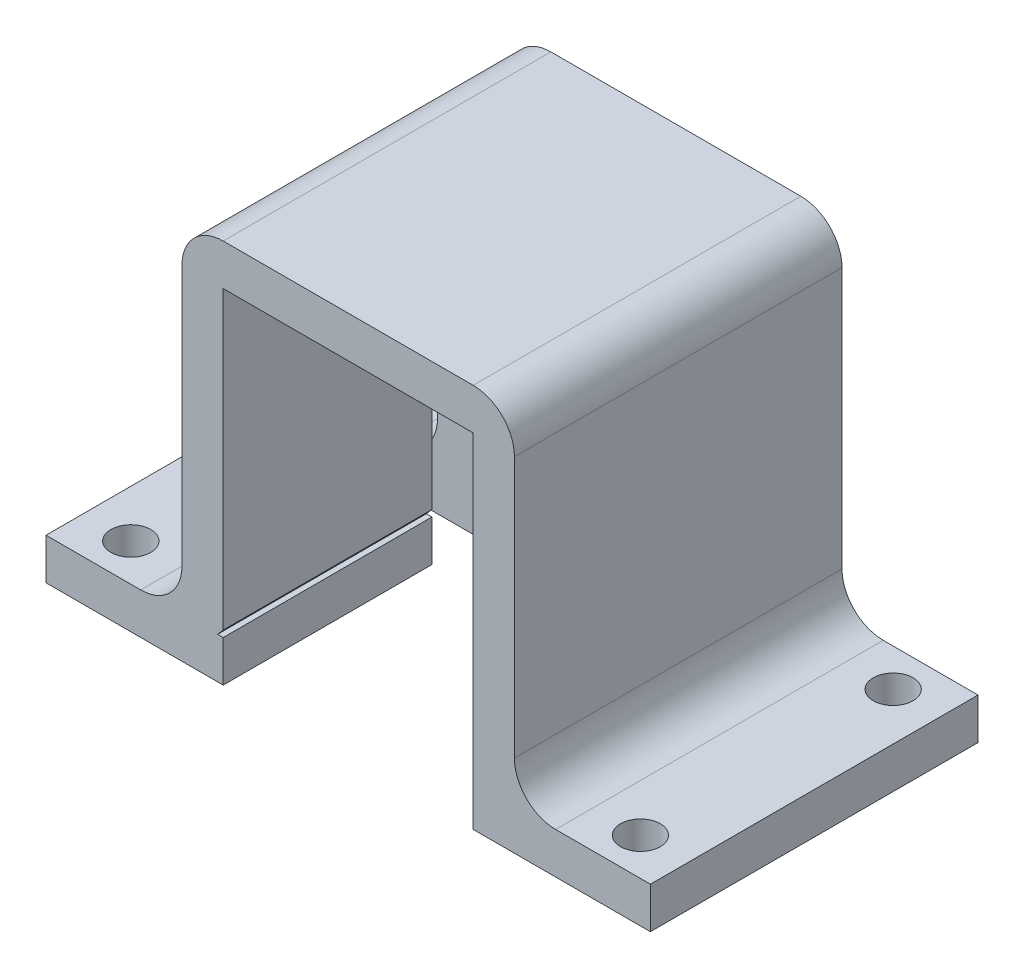
from build123d import *

# Parameters (mm, degrees)
BOSS_EXTRUDE1_DEPTH     = 23.85
SKETCH4_R               = 1.45
CUT_EXTRUDE3_DEPTH      = 10
CUT_EXTRUDE4_DEPTH      = 10
CUT_EXTRUDE4_DEPTH_BACK = 10
SKETCH10_W              = 3.4
SKETCH10_H              = 20


with BuildPart() as part:
    # Sketch1 → Boss-Extrude1 (new body)
    with BuildSketch(Plane.XY):
        with BuildLine():
            Line((-9.1, -10.52892562), (-9.1, 11))
            Line((-9.1, 11), (9.1, 11))
            Line((9.1, 11), (9.1, -11))
            Line((9.1, -11), (9.1, -14))
            Line((9.1, -14), (12.1, -14))
            Line((12.1, -14), (22, -14))
            Line((22, -14), (22, -11))
            Line((22, -11), (15.1, -11))
            ThreePointArc((15.1, -11), (12.978679656, -10.121320344), (12.1, -8))
            Line((12.1, -8), (12.1, 11))
            ThreePointArc((12.1, 11), (11.221320344, 13.121320344), (9.1, 14))
            Line((9.1, 14), (-9.1, 14))
            ThreePointArc((-9.1, 14), (-11.221320344, 13.121320344), (-12.1, 11))
            Line((-12.1, 11), (-12.1, -8))
            ThreePointArc((-12.1, -8), (-12.978679656, -10.121320344), (-15.1, -11))
            Line((-15.1, -11), (-22, -11))
            Line((-22, -11), (-22, -14))
            Line((-22, -14), (-12.1, -14))
            Line((-12.1, -14), (-9.1, -14))
            Line((-9.1, -14), (-9.1, -11))
            Line((-9.1, -11), (-9.507142857, -11))
            Line((-9.507142857, -11), (-9.1, -10.52892562))
        make_face()
    extrude(amount=BOSS_EXTRUDE1_DEPTH)

    # Sketch4 → Cut-Extrude3 (cut)
    with BuildSketch(Plane(origin=(0, -11, 0), x_dir=(1, 0, 0), z_dir=(0, 1, 0))):
        with Locations((-18.55, -21.125)):
            Circle(SKETCH4_R)
        with Locations((-18.55, -2.725)):
            Circle(SKETCH4_R)
        with Locations((18.55, -21.125)):
            Circle(SKETCH4_R)
        with Locations((18.55, -2.725)):
            Circle(SKETCH4_R)
    extrude(amount=-CUT_EXTRUDE3_DEPTH, mode=Mode.SUBTRACT)

    # Sketch10 → Cut-Extrude4 (cut, two sides: drawn at the far end of the back side and taken through both)
    with BuildSketch(Plane.ZY.offset(12.1).offset(-CUT_EXTRUDE4_DEPTH_BACK)):
        with Locations((6.95, -4)):
            Rectangle(SKETCH10_W, SKETCH10_H)
    extrude(amount=CUT_EXTRUDE4_DEPTH + CUT_EXTRUDE4_DEPTH_BACK, mode=Mode.SUBTRACT)


solid = part.part
